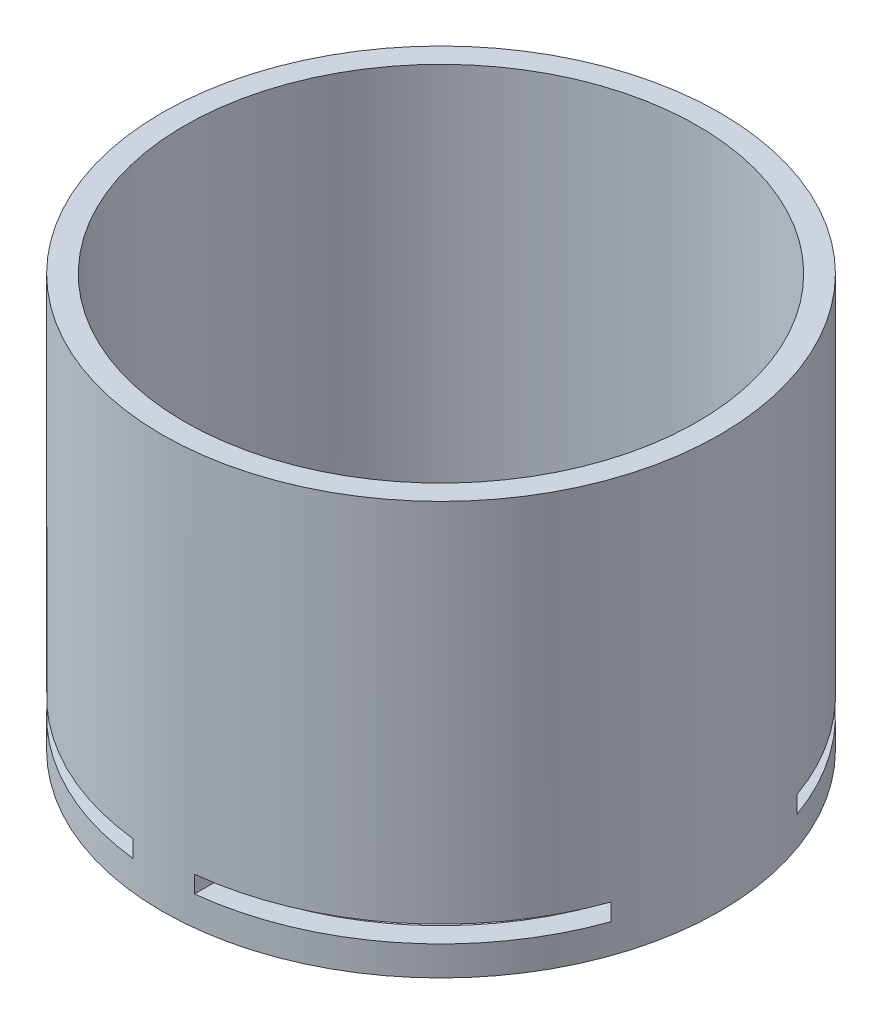
from build123d import *

# Parameters (mm, degrees)
SKETCH1_R               = 60.071
BOSS_EXTRUDE1_DEPTH     = 88.9
SKETCH2_R               = 55.245
CUT_EXTRUDE1_DEPTH      = 123.964466745
CUT_EXTRUDE4_DEPTH      = 123.964466745
CUT_EXTRUDE4_DEPTH_BACK = 123.964466745
SKETCH6_W               = 50.038
SKETCH6_H               = 3.683


with BuildPart() as part:
    # Sketch1 → Boss-Extrude1 (new body)
    with BuildSketch(Plane(origin=(0, 0, 0), x_dir=(1, 0, 0), z_dir=(0, 1, 0))):
        with Locations(Location((0, 0, 0), (0, 0, 270))):
            Circle(SKETCH1_R)
    extrude(amount=BOSS_EXTRUDE1_DEPTH)

    # Sketch2 → Cut-Extrude1 (cut, through all)
    with BuildSketch(Plane(origin=(0, 88.9, 0), x_dir=(1, 0, 0), z_dir=(0, 1, 0))):
        with Locations(Location((0, 0, 0), (0, 0, 270))):
            Circle(SKETCH2_R)
    extrude(amount=-CUT_EXTRUDE1_DEPTH, mode=Mode.SUBTRACT)

    # Sketch6 → Cut-Extrude4 (cut, two sides: drawn at the far end of the back side and taken through both)
    with BuildSketch(Plane.XY.offset(-CUT_EXTRUDE4_DEPTH_BACK)):
        with Locations((-31.623, 8.1915)):
            Rectangle(SKETCH6_W, SKETCH6_H)
        with Locations((31.623, 8.1915)):
            Rectangle(SKETCH6_W, SKETCH6_H)
    extrude(amount=CUT_EXTRUDE4_DEPTH + CUT_EXTRUDE4_DEPTH_BACK, mode=Mode.SUBTRACT)


solid = part.part
